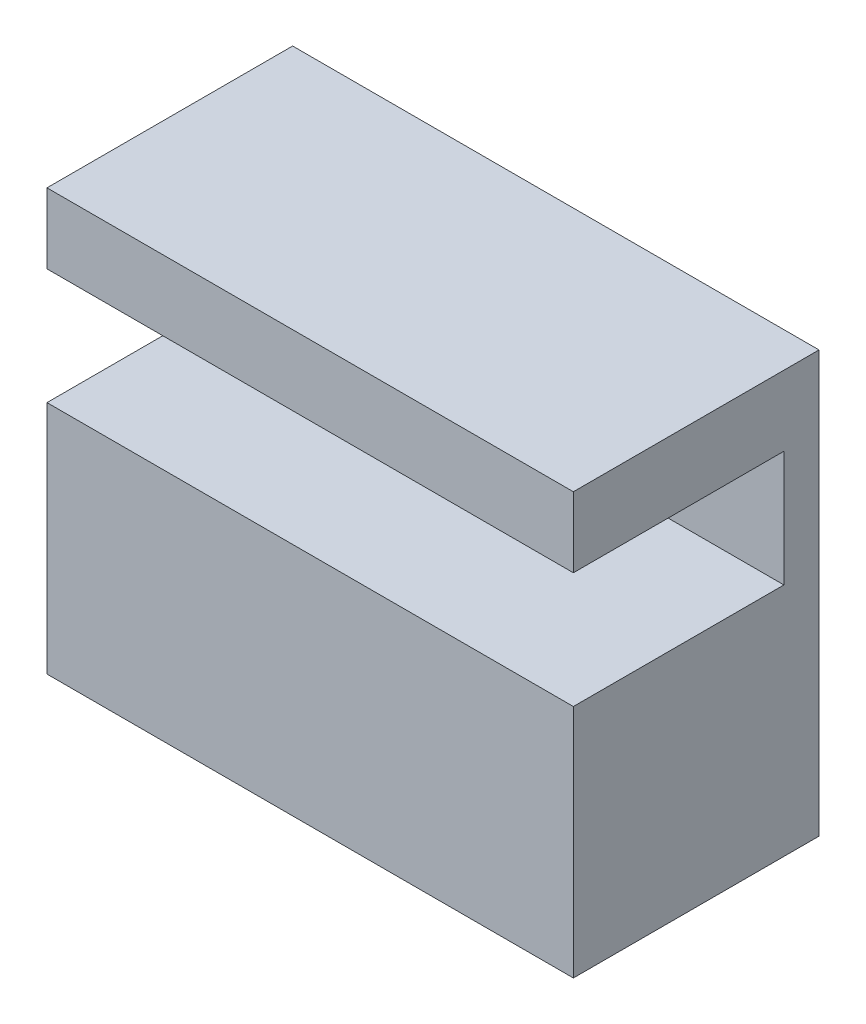
from build123d import *

# Parameters (mm, degrees)
SKETCH_1_W          = 15
SKETCH_1_H          = 12
EXTRUDE_1_DEPTH     = 7
SKETCH_2_W          = 15
SKETCH_2_H          = 3.3
CUT_EXTRUDE_1_DEPTH = 6


with BuildPart() as part:
    # 草图1 → 凸台-拉伸1 (new body)
    with BuildSketch(Plane.XY):
        Rectangle(SKETCH_1_W, SKETCH_1_H)
    extrude(amount=EXTRUDE_1_DEPTH)

    # 草图2 → 切除-拉伸1 (cut)
    with BuildSketch(Plane.XY.offset(7)):
        with Locations((0, 2.35)):
            Rectangle(SKETCH_2_W, SKETCH_2_H)
    extrude(amount=-CUT_EXTRUDE_1_DEPTH, mode=Mode.SUBTRACT)


solid = part.part
